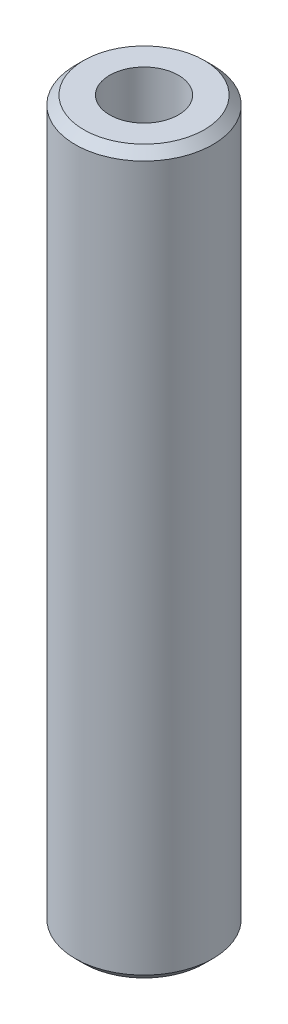
from build123d import *

# Parameters (mm, degrees)
SKETCH1_R           = 4
SKETCH1_R_2         = 2
BOSS_EXTRUDE1_DEPTH = 42
CHAMFER1_SIZE       = 0.5


with BuildPart() as part:
    # Sketch1 → Boss-Extrude1 (new body)
    with BuildSketch(Plane(origin=(0, 0, 0), x_dir=(1, 0, 0), z_dir=(0, 1, 0))):
        with Locations(Location((0, 0, 0), (0, 0, 90))):
            Circle(SKETCH1_R)
        with Locations(Location((0, 0, 0), (0, 0, 90))):
            Circle(SKETCH1_R_2, mode=Mode.SUBTRACT)
    extrude(amount=BOSS_EXTRUDE1_DEPTH)

    # Chamfer1
    chamfer1_edges = [part.edges().sort_by_distance(p)[0] for p in [
        (0, 0, 4),
        (0, 42, 4),
    ]]
    chamfer(chamfer1_edges, length=CHAMFER1_SIZE)


solid = part.part
